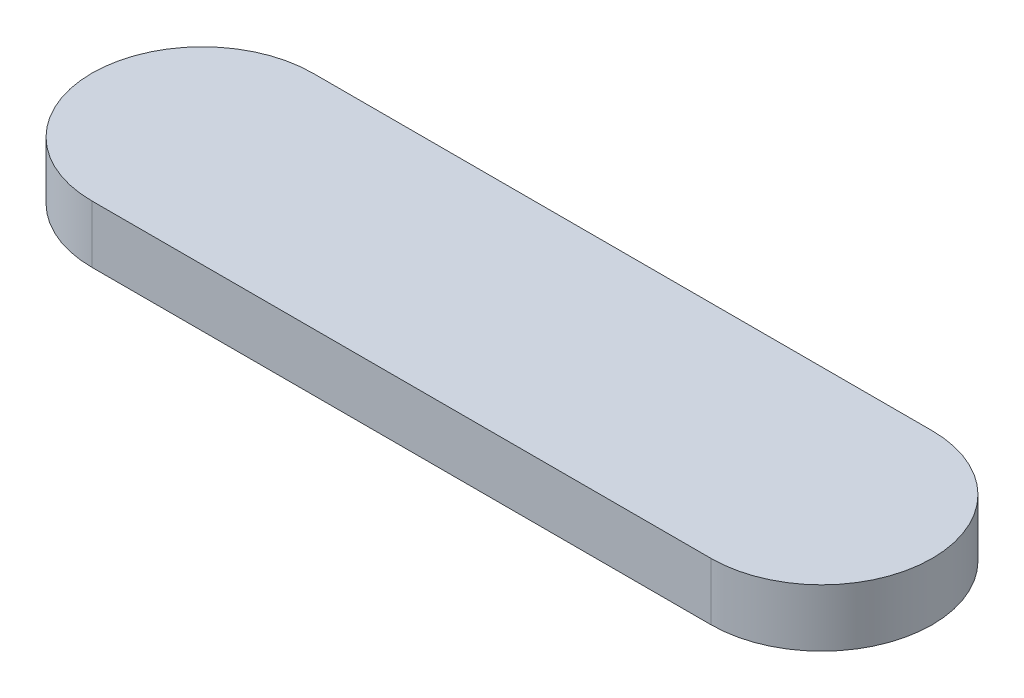
from build123d import *

# Parameters (mm, degrees)
BOSS_EXTRUDE1_DEPTH = 13


with BuildPart() as part:
    # Sketch1 → Boss-Extrude1 (new body)
    with BuildSketch(Plane(origin=(0, 0, 0), x_dir=(1, 0, 0), z_dir=(0, 1, 0))):
        with BuildLine():
            Line((0, 25), (140, 25))
            ThreePointArc((140, 25), (165, 0), (140, -25))
            Line((140, -25), (0, -25))
            ThreePointArc((0, -25), (-25, 0), (0, 25))
        make_face()
    extrude(amount=BOSS_EXTRUDE1_DEPTH)


solid = part.part
